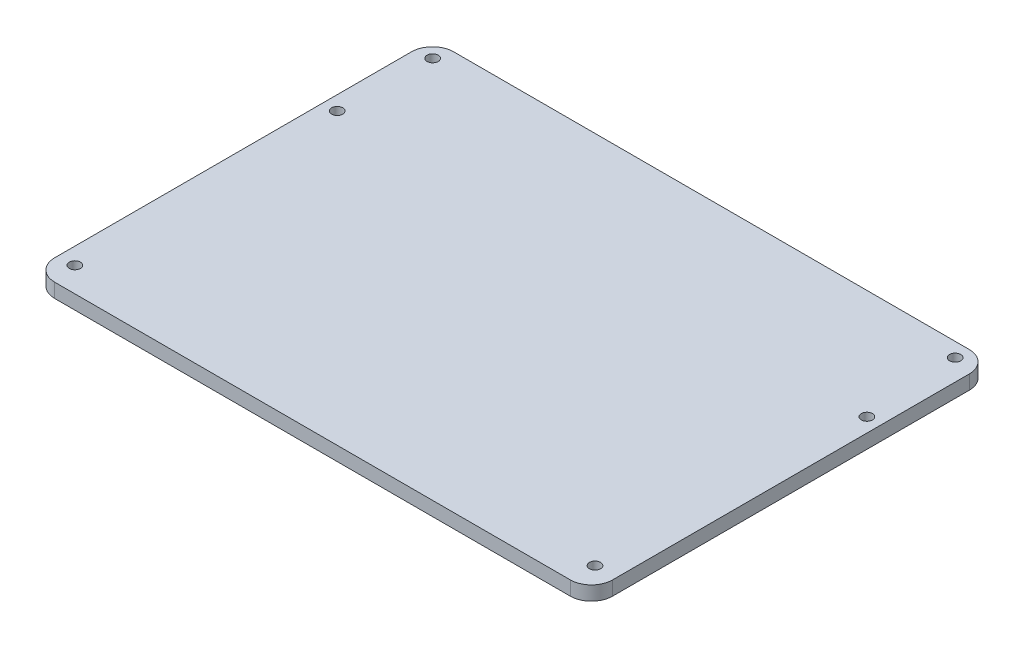
from build123d import *

# Parameters (mm, degrees)
BOSS_EXTRUDE1_DEPTH = 5.08
SKETCH2_R           = 2
SKETCH2_R_2         = 2.000000064
CUT_EXTRUDE1_DEPTH  = 167.258702267


with BuildPart() as part:
    # Sketch1 → Boss-Extrude1 (new body)
    with BuildSketch(Plane(origin=(0, 0, 0), x_dir=(1, 0, 0), z_dir=(0, 1, 0))):
        with BuildLine():
            Line((-75.992267658, 25.543996283), (109.427732342, 25.543996283))
            ThreePointArc((109.427732342, 25.543996283), (114.815886015, 23.312149955), (117.047732342, 17.923996283))
            Line((117.047732342, 17.923996283), (117.047732342, -110.346003717))
            ThreePointArc((117.047732342, -110.346003717), (114.815886015, -115.73415739), (109.427732342, -117.966003717))
            Line((109.427732342, -117.966003717), (-75.992267658, -117.966003717))
            ThreePointArc((-75.992267658, -117.966003717), (-81.380421331, -115.73415739), (-83.612267658, -110.346003717))
            Line((-83.612267658, -110.346003717), (-83.612267658, 17.923996283))
            ThreePointArc((-83.612267658, 17.923996283), (-81.380421331, 23.312149955), (-75.992267658, 25.543996283))
        make_face()
    extrude(amount=BOSS_EXTRUDE1_DEPTH)

    # Sketch2 → Cut-Extrude1 (cut, through all)
    with BuildSketch(Plane(origin=(0, 5.08, 0), x_dir=(1, 0, 0), z_dir=(0, 1, 0))):
        with Locations(Location((-77.770267658, 19.737919103, 0), (0, 0, 270))):
            Circle(SKETCH2_R)
        with Locations(Location((-78.532267658, -13.826003717, 0), (0, 0, 270))):
            Circle(SKETCH2_R)
        with Locations((-78.532267658, -131.936003717)):
            Circle(SKETCH2_R)
        with Locations(Location((-77.643267658, -109.076003717, 0), (0, 0, 270))):
            Circle(SKETCH2_R_2)
        with Locations(Location((109.427732342, -109.076003717, 0), (0, 0, 270))):
            Circle(SKETCH2_R)
        with Locations((111.967732342, -131.936003717)):
            Circle(SKETCH2_R)
        with Locations(Location((111.967732342, -13.826003717, 0), (0, 0, 270))):
            Circle(SKETCH2_R)
        with Locations(Location((109.427732342, 20.463996283, 0), (0, 0, 270))):
            Circle(SKETCH2_R)
    extrude(amount=-CUT_EXTRUDE1_DEPTH, mode=Mode.SUBTRACT)


solid = part.part
